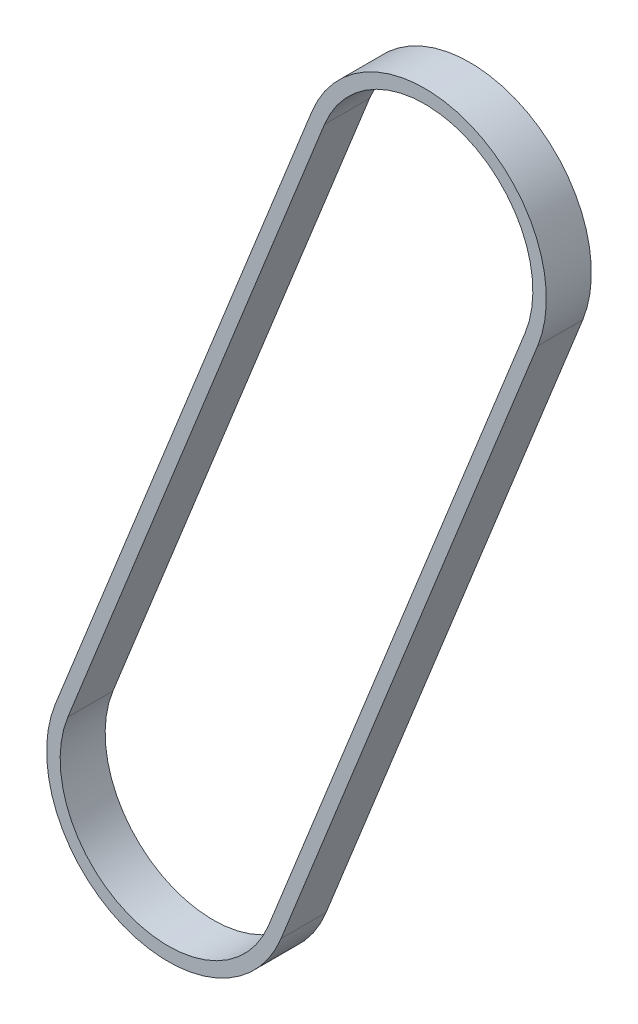
from build123d import *

# Parameters (mm, degrees)
SURFACE_EXTRUDE1_1_BACK  = 10
SURFACE_EXTRUDE1_1_DEPTH = 10
THICKEN1_T1              = 3


with BuildPart() as body_1:
    # Surface-Extrude1: a surface, the sketch's curves swept straight by 10 mm
    with BuildLine(Plane.XY.offset(-SURFACE_EXTRUDE1_1_BACK), mode=Mode.PRIVATE) as surface_extrude1_1_path:
        Line((-22.283440581, 8.913376232), (34.716559419, 151.413376232))
        ThreePointArc((34.716559419, 151.413376232), (65.913376232, 164.783440581), (79.283440581, 133.586623767))
        Line((79.283440581, 133.586623767), (22.283440581, -8.913376232))
        ThreePointArc((22.283440581, -8.913376232), (-8.913376232, -22.283440581), (-22.283440581, 8.913376232))
    surface_extrude1_1 = Shell.extrude(surface_extrude1_1_path.wire(), (0 * SURFACE_EXTRUDE1_1_DEPTH, 0 * SURFACE_EXTRUDE1_1_DEPTH, 1 * SURFACE_EXTRUDE1_1_DEPTH))
    add(Solid.thicken(surface_extrude1_1, THICKEN1_T1))


solid = body_1.part
